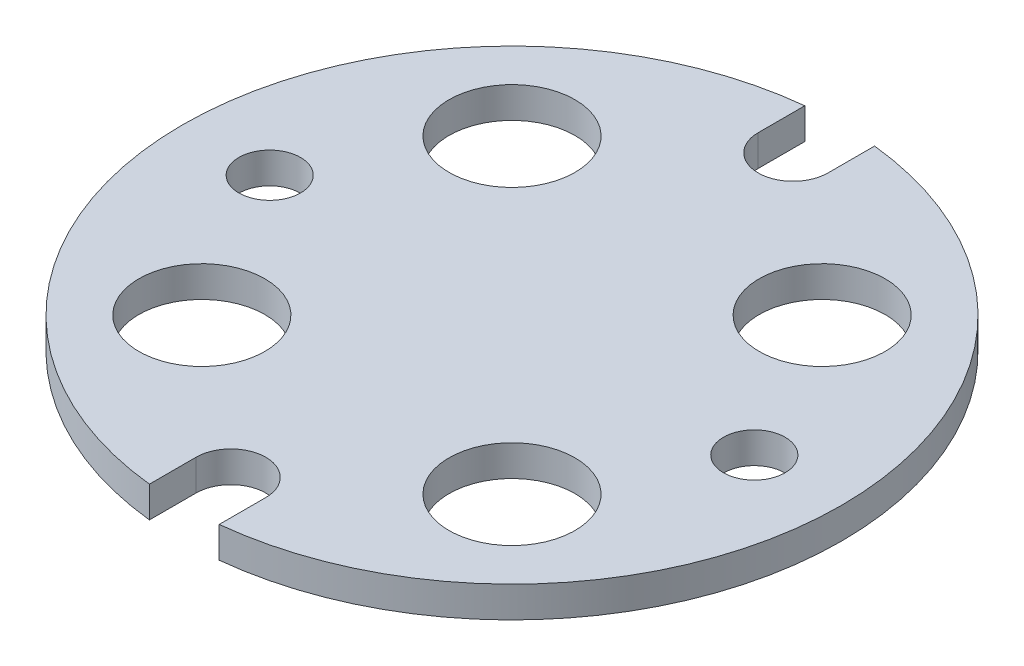
from build123d import *

# Parameters (mm, degrees)
SKETCH1_R           = 17
BOSS_EXTRUDE1_DEPTH = 1.6
SKETCH2_R           = 1.59
SKETCH2_R_2         = 3.25
CUT_EXTRUDE1_DEPTH  = 25.09481272


with BuildPart() as part:
    # Sketch1 → Boss-Extrude1 (new body)
    with BuildSketch(Plane(origin=(0, 0, 0), x_dir=(1, 0, 0), z_dir=(0, 1, 0))):
        with Locations(Location((0, 0, 0), (0, 0, 270))):
            Circle(SKETCH1_R)
    extrude(amount=BOSS_EXTRUDE1_DEPTH)

    # Sketch2 → Cut-Extrude1 (cut, through all)
    with BuildSketch(Plane.XZ):
        with Locations(Location((12.5, 0, 0), (0, 0, 270))):
            Circle(SKETCH2_R)
        with Locations(Location((-12.5, 0, 0), (0, 0, 270))):
            Circle(SKETCH2_R)
        with Locations(Location((8, 8, 0), (0, 0, 270))):
            Circle(SKETCH2_R_2)
        with Locations(Location((8, -8, 0), (0, 0, 270))):
            Circle(SKETCH2_R_2)
        with Locations(Location((-8, -8, 0), (0, 0, 270))):
            Circle(SKETCH2_R_2)
        with Locations(Location((-8, 8, 0), (0, 0, 270))):
            Circle(SKETCH2_R_2)
        with BuildLine():
            Line((-1.8, 14.5), (-1.8, 16.904437287))
            ThreePointArc((-1.8, 16.904437287), (0, 17), (1.8, 16.904437287))
            Line((1.8, 16.904437287), (1.8, 14.5))
            ThreePointArc((1.8, 14.5), (0, 12.7), (-1.8, 14.5))
        make_face()
        with BuildLine():
            Line((1.8, -14.5), (1.8, -16.904437287))
            ThreePointArc((1.8, -16.904437287), (0, -17), (-1.8, -16.904437287))
            Line((-1.8, -16.904437287), (-1.8, -14.5))
            ThreePointArc((-1.8, -14.5), (0, -12.7), (1.8, -14.5))
        make_face()
    extrude(amount=-CUT_EXTRUDE1_DEPTH, mode=Mode.SUBTRACT)


solid = part.part
